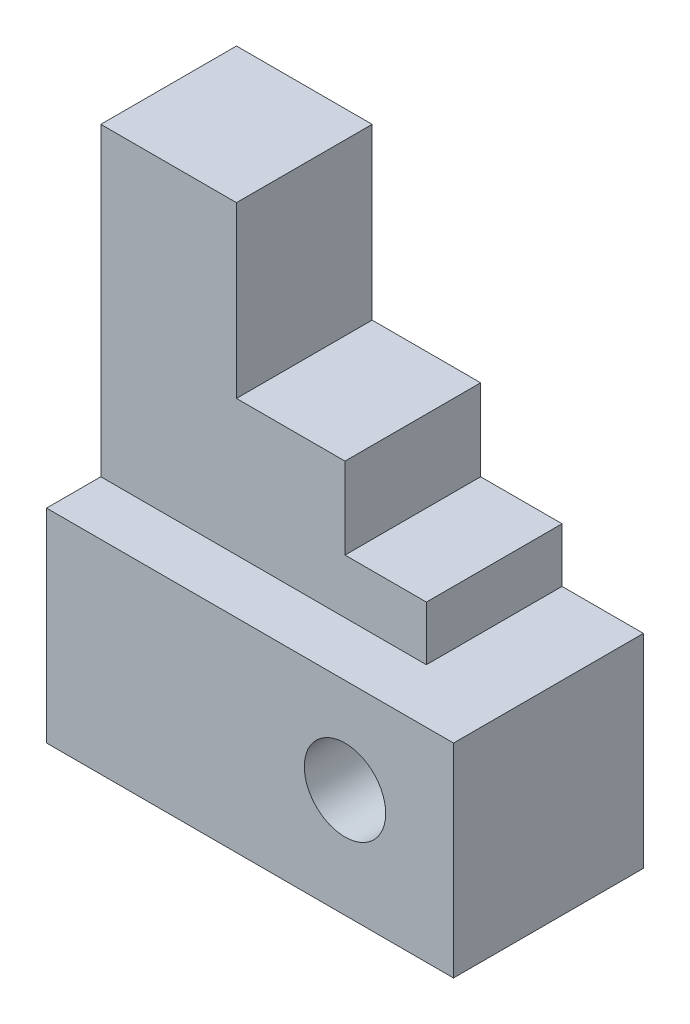
from build123d import *

# Parameters (mm, degrees)
SKETCH2_R           = 6
BOSS_EXTRUDE2_DEPTH = 28
CUT_EXTRUDE1_DEPTH  = 8


with BuildPart() as part:
    # Sketch2 → Boss-Extrude2 (new body)
    with BuildSketch(Plane.XY):
        Polygon((0, 0), (0, 30), (-12, 30), (-12, 38), (-24, 38), (-24, 50), (-40, 50), (-40, 75), (-60, 75), (-60, 0), align=None)
        with Locations((-16, 16)):
            Circle(SKETCH2_R, mode=Mode.SUBTRACT)
    extrude(amount=-BOSS_EXTRUDE2_DEPTH)

    # Sketch2<11> → Cut-Extrude1 (cut)
    with BuildSketch(Plane.XY):
        Polygon((-60, 30), (-12, 30), (-12, 38), (-24, 38), (-24, 50), (-40, 50), (-40, 75), (-60, 75), align=None)
    extrude(amount=-CUT_EXTRUDE1_DEPTH, mode=Mode.SUBTRACT)


solid = part.part
